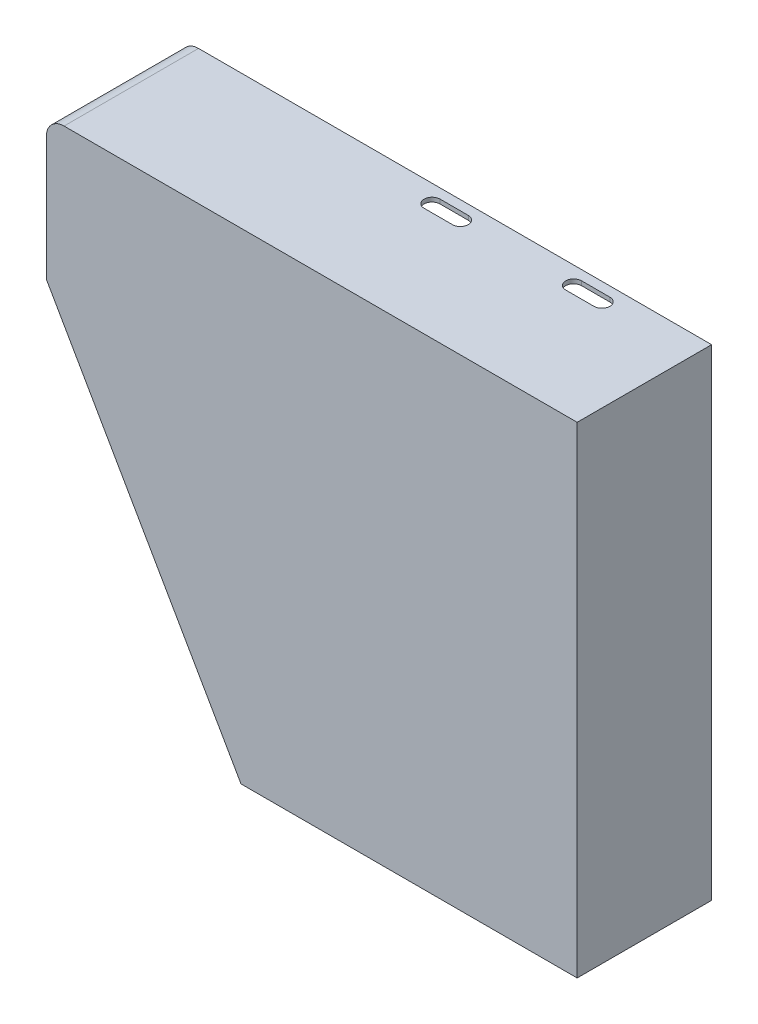
from build123d import *

# Parameters (mm, degrees)
EXTRUDE_1_DEPTH          = 38
SHELL_1_T                = -1.2
CUT_EXTRUDE_1_DEPTH      = 207.009708509
CUT_EXTRUDE_1_DEPTH_BACK = 207.009708509


with BuildPart() as part:
    # 草图1 → 凸台-拉伸1 (new body)
    with BuildSketch(Plane.XY):
        with BuildLine():
            Line((-150, 96), (-95, 0))
            Line((-95, 0), (0, 0))
            Line((0, 0), (0, 136))
            Line((0, 136), (-145, 136))
            ThreePointArc((-145, 136), (-148.535533906, 134.535533906), (-150, 131))
            Line((-150, 131), (-150, 96))
        make_face()
    extrude(amount=EXTRUDE_1_DEPTH)

    # 抽壳1
    shell_1_openings = [part.faces().sort_by_distance(p)[0] for p in [
        (-66.551705403, 73.332757841, 0),
    ]]
    offset(amount=SHELL_1_T, openings=shell_1_openings, kind=Kind.INTERSECTION)

    # 草图3 → 切除-拉伸1 (cut, two sides: drawn at the far end of the back side and taken through both)
    with BuildSketch(Plane.XZ.offset(-CUT_EXTRUDE_1_DEPTH_BACK)):
        with BuildLine():
            Line((-66, 7.25), (-74, 7.25))
            ThreePointArc((-74, 7.25), (-76.25, 5), (-74, 2.75))
            Line((-74, 2.75), (-66, 2.75))
            ThreePointArc((-66, 2.75), (-63.75, 5), (-66, 7.25))
        make_face()
        with BuildLine():
            Line((-26, 7.25), (-34, 7.25))
            ThreePointArc((-34, 7.25), (-36.25, 5), (-34, 2.75))
            Line((-34, 2.75), (-26, 2.75))
            ThreePointArc((-26, 2.75), (-23.75, 5), (-26, 7.25))
        make_face()
    extrude(amount=CUT_EXTRUDE_1_DEPTH + CUT_EXTRUDE_1_DEPTH_BACK, mode=Mode.SUBTRACT)


solid = part.part
